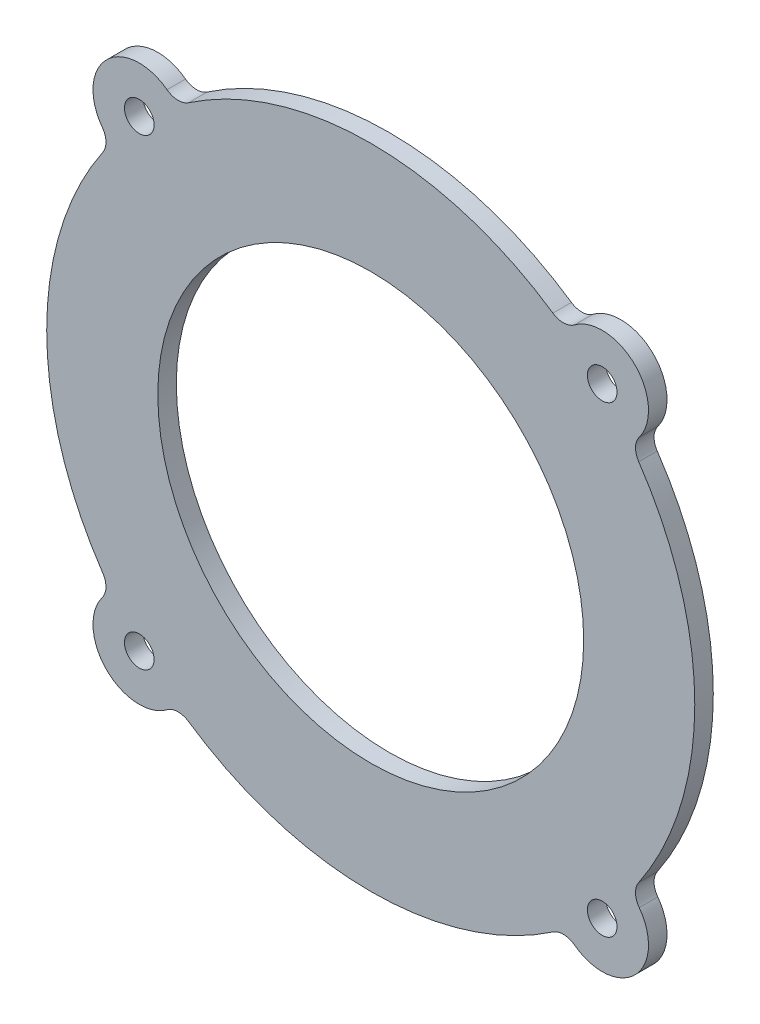
from build123d import *

# Parameters (mm, degrees)
SKETCH1_R           = 23
SKETCH1_R_2         = 1.6
BOSS_EXTRUDE1_DEPTH = 2


with BuildPart() as part:
    # Sketch1 → Boss-Extrude1 (new body)
    with BuildSketch(Plane.XY):
        with BuildLine():
            ThreePointArc((-28.945945946, 19.675675676), (-35, 0), (-28.945945946, -19.675675676))
            ThreePointArc((-28.945945946, -19.675675676), (-28.600540614, -20.846499055), (-29, -22))
            ThreePointArc((-29, -22), (-28.535533906, -28.535533906), (-22, -29))
            ThreePointArc((-22, -29), (-20.846499055, -28.600540614), (-19.675675676, -28.945945946))
            ThreePointArc((-19.675675676, -28.945945946), (0, -35), (19.675675676, -28.945945946))
            ThreePointArc((19.675675676, -28.945945946), (20.846499055, -28.600540614), (22, -29))
            ThreePointArc((22, -29), (28.535533906, -28.535533906), (29, -22))
            ThreePointArc((29, -22), (28.600540614, -20.846499055), (28.945945946, -19.675675676))
            ThreePointArc((28.945945946, -19.675675676), (35, 0), (28.945945946, 19.675675676))
            ThreePointArc((28.945945946, 19.675675676), (28.600540614, 20.846499055), (29, 22))
            ThreePointArc((29, 22), (28.535533906, 28.535533906), (22, 29))
            ThreePointArc((22, 29), (20.846499055, 28.600540614), (19.675675676, 28.945945946))
            ThreePointArc((19.675675676, 28.945945946), (0, 35), (-19.675675676, 28.945945946))
            ThreePointArc((-19.675675676, 28.945945946), (-20.846499055, 28.600540614), (-22, 29))
            ThreePointArc((-22, 29), (-28.535533906, 28.535533906), (-29, 22))
            ThreePointArc((-29, 22), (-28.600540614, 20.846499055), (-28.945945946, 19.675675676))
        make_face()
        Circle(SKETCH1_R, mode=Mode.SUBTRACT)
        with Locations((-25, 25)):
            Circle(SKETCH1_R_2, mode=Mode.SUBTRACT)
        with Locations((25, 25)):
            Circle(SKETCH1_R_2, mode=Mode.SUBTRACT)
        with Locations((-25, -25)):
            Circle(SKETCH1_R_2, mode=Mode.SUBTRACT)
        with Locations((25, -25)):
            Circle(SKETCH1_R_2, mode=Mode.SUBTRACT)
    extrude(amount=BOSS_EXTRUDE1_DEPTH)


solid = part.part
